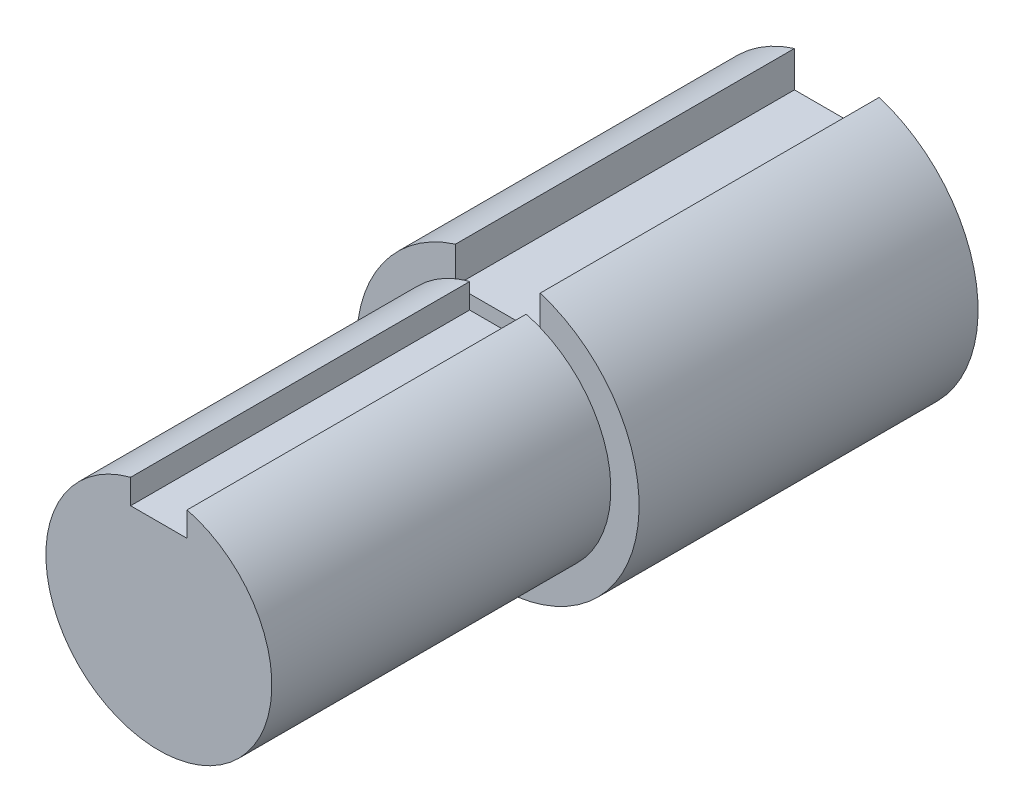
from build123d import *

# Parameters (mm, degrees)
BOSS_EXTRUDE1_DEPTH = 19.05
BOSS_EXTRUDE2_DEPTH = 19.05


with BuildPart() as part:
    # Sketch1 → Boss-Extrude1 (new body)
    with BuildSketch(Plane.XY):
        with BuildLine():
            Line((-2.38125, 7.571892411), (-2.38125, 5.55625))
            Line((-2.38125, 5.55625), (2.38125, 5.55625))
            Line((2.38125, 5.55625), (2.38125, 7.571892411))
            ThreePointArc((2.38125, 7.571892411), (0, -7.9375), (-2.38125, 7.571892411))
        make_face()
    extrude(amount=BOSS_EXTRUDE1_DEPTH)

    # Sketch2 → Boss-Extrude2 (add)
    with BuildSketch(Plane.XY.offset(19.05)):
        with BuildLine():
            Line((-1.5875, 6.148361062), (-1.5875, 4.7625))
            Line((-1.5875, 4.7625), (1.5875, 4.7625))
            Line((1.5875, 4.7625), (1.5875, 6.148361062))
            ThreePointArc((1.5875, 6.148361062), (0, -6.35), (-1.5875, 6.148361062))
        make_face()
    extrude(amount=BOSS_EXTRUDE2_DEPTH)


solid = part.part
